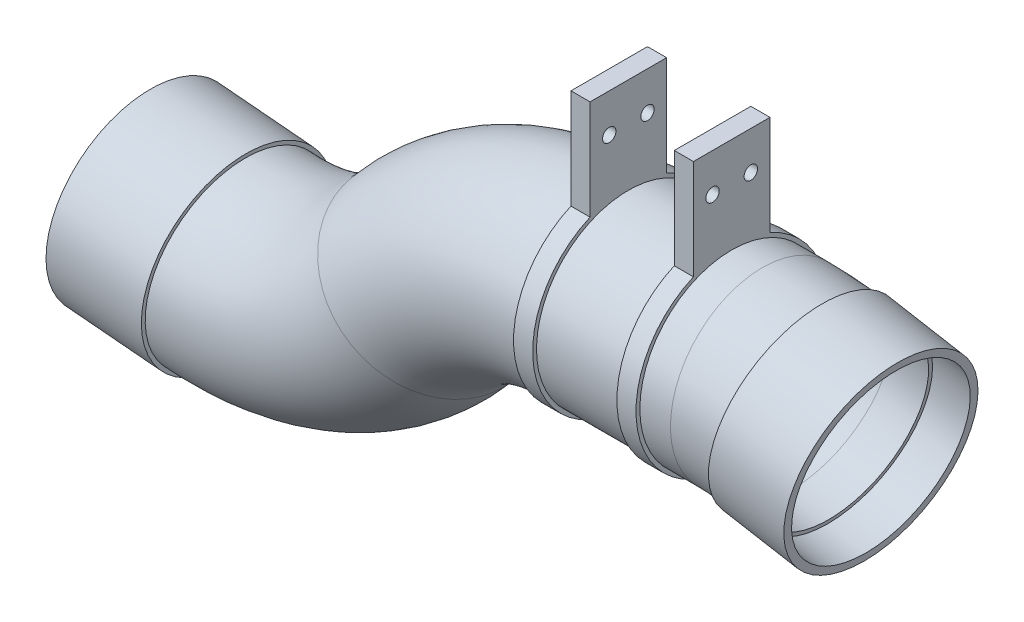
from build123d import *

# Parameters (mm, degrees)
SKETCH_1_R             = 24
SKETCH_1_R_2           = 22
EXTRUDE_1_DEPTH        = 15
EXTRUDE_1_DEPTH_BACK   = 10
SKETCH_3_R             = 25
SKETCH_3_R_2           = 23
EXTRUDE_2_DEPTH        = 10
EXTRUDE_2_DEPTH_BACK   = 10
SKETCH_4_R             = 25
SKETCH_4_R_2           = 23
EXTRUDE_START          = -5
SKETCH_12_R            = 24
EXTRUDE_4_DEPTH        = 5
SKETCH_16_R            = 1.75
CUT_EXTRUDE_1_DEPTH    = 5
PATTERN_LINEAR_1_COUNT = 2
PATTERN_LINEAR_1_PITCH = 27


with BuildPart() as part:
    # 扫描1: sweep along a path in 草图2
    with BuildLine(Plane.XY) as sweep_1_path:
        Line((0, 0), (9.961946981, -0.871557427))
        ThreePointArc((9.961946981, -0.871557427), (38.152297488, 3.467352507), (61.153958133, 20.332867877))
        ThreePointArc((61.153958133, 20.332867877), (81.759529016, 36.144078518), (107.11662472, 41.765611296))
        Line((107.11662472, 41.765611296), (147.11662472, 41.765611296))
        ThreePointArc((147.11662472, 41.765611296), (152.781747999, 41.518266672), (158.403756268, 40.778115241))
        Line((158.403756268, 40.778115241), (168.251833799, 39.041633465))
    # 草图1 → 扫描1 (sweep)
    with BuildSketch(Plane(origin=(0, 0, 0), x_dir=(-0.08715574274765836, -0.9961946980917455, 0), z_dir=(0.9961946980917455, -0.08715574274765836, 0))):
        Circle(SKETCH_1_R)
        Circle(SKETCH_1_R_2, mode=Mode.SUBTRACT)
    sweep(path=sweep_1_path.line)

    # 草图12 → 凸台-拉伸4 (add)
    with BuildSketch(Plane(origin=(107.11662472, 0, -146.45089194), x_dir=(0, 0, 1), z_dir=(-1, 0, 0)).offset(EXTRUDE_START)):
        with BuildLine():
            Line((136.45089194, 64.67848977), (136.45089194, 90.765611296))
            Line((136.45089194, 90.765611296), (156.45089194, 90.765611296))
            Line((156.45089194, 90.765611296), (156.45089194, 64.67848977))
            ThreePointArc((156.45089194, 64.67848977), (146.45089194, 16.765611296), (136.45089194, 64.67848977))
        make_face()
        with Locations(Location((146.45089194, 41.765611296, 0), (0, 0, 90))):
            Circle(SKETCH_12_R, mode=Mode.SUBTRACT)
    extrude_4 = extrude(amount=EXTRUDE_4_DEPTH)

    # 草图16 → 切除-拉伸1 (cut)
    with BuildSketch(Plane(origin=(112.11662472, 0, 0), x_dir=(0, 0, -1), z_dir=(1, 0, 0))):
        with Locations(Location((-5, 80.765611296, 0), (0, 0, 90))):
            Circle(SKETCH_16_R)
        with Locations(Location((5, 80.765611296, 0), (0, 0, 90))):
            Circle(SKETCH_16_R)
    cut_extrude_1 = extrude(amount=-CUT_EXTRUDE_1_DEPTH, mode=Mode.SUBTRACT)

    # 阵列(线性)1: 凸台-拉伸4, 切除-拉伸1 ×2
    with Locations(*[(i * PATTERN_LINEAR_1_PITCH, 0, 0) for i in range(1, PATTERN_LINEAR_1_COUNT)]):
        add(extrude_4)
        add(cut_extrude_1, mode=Mode.SUBTRACT)


with BuildPart() as body_2:
    # 草图3 → 凸台-拉伸1 (new, two sides: drawn at the far end of the back side and taken through both)
    with BuildSketch(Plane(origin=(0, 0, 0), x_dir=(-0.08715574274765837, -0.9961946980917457, 0), z_dir=(-0.9961946980917457, 0.08715574274765837, 0)).offset(-EXTRUDE_1_DEPTH_BACK)):
        Circle(SKETCH_3_R)
        Circle(SKETCH_3_R_2, mode=Mode.SUBTRACT)
    extrude(amount=EXTRUDE_1_DEPTH + EXTRUDE_1_DEPTH_BACK)


with BuildPart() as body_3:
    # 草图4 → 凸台-拉伸2 (new, two sides: drawn at the far end of the back side and taken through both)
    with BuildSketch(Plane(origin=(156.50190769, -27.595508858, 0), x_dir=(0.17364817766692361, 0.9848077530122092, 0), z_dir=(-0.9848077530122092, 0.17364817766692361, 0)).offset(-EXTRUDE_2_DEPTH_BACK)):
        with Locations(Location((67.665127655, 0, 0), (0, 0, 180))):
            Circle(SKETCH_4_R)
        with Locations(Location((67.665127655, 0, 0), (0, 0, 180))):
            Circle(SKETCH_4_R_2, mode=Mode.SUBTRACT)
    extrude(amount=EXTRUDE_2_DEPTH + EXTRUDE_2_DEPTH_BACK)


solid = Compound([part.part, body_2.part, body_3.part])
